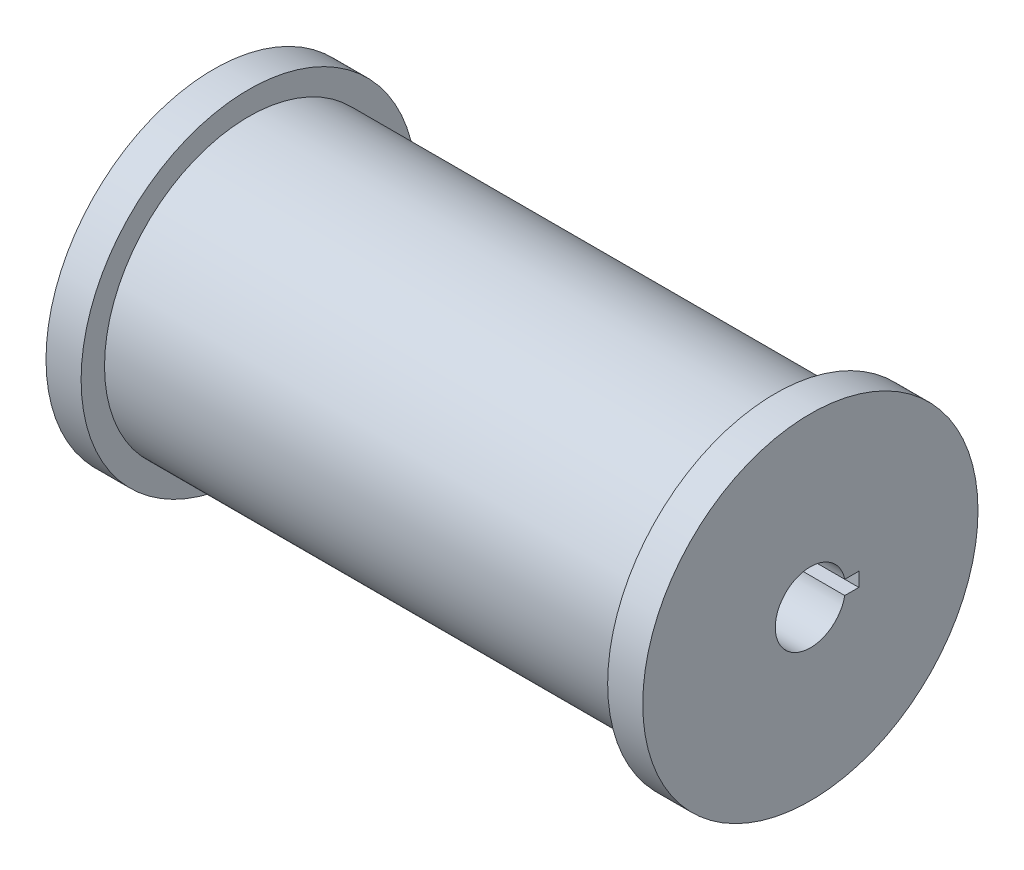
from build123d import *

# Parameters (mm, degrees)
CUT_EXTRUDE_START   = -15
CUT_EXTRUDE_1_DEPTH = 15


with BuildPart() as part:
    # 草图1 → 旋转1 (revolve)
    with BuildSketch(Plane(origin=(0, 0, 0), x_dir=(1, 0, 0), z_dir=(0, 1, 0)), mode=Mode.PRIVATE) as revolve_1_sk:
        Polygon((-85, 10), (-85, 47.75), (-75, 47.75), (-75, 41.078952229), (75, 41.078952229), (75, 47.75), (85, 47.75), (85, 10), align=None)
    revolve(revolve_1_sk.sketch.rotate(Axis((-58.327347129, 0, 0), (1, 0, 0)), 180), axis=Axis((-58.327347129, 0, 0), (1, 0, 0)))

    # 草图2 → 切除-拉伸1 (cut)
    with BuildSketch(Plane(origin=(85, 0, 0), x_dir=(0, 0, -1), z_dir=(1, 0, 0)).offset(CUT_EXTRUDE_START)):
        with BuildLine():
            Line((9.797958971, 2), (13.797958971, 2))
            Line((13.797958971, 2), (13.797958971, -2))
            Line((13.797958971, -2), (9.797958971, -2))
            ThreePointArc((9.797958971, -2), (10, 0), (9.797958971, 2))
        make_face()
    extrude(amount=CUT_EXTRUDE_1_DEPTH, mode=Mode.SUBTRACT)


solid = part.part
